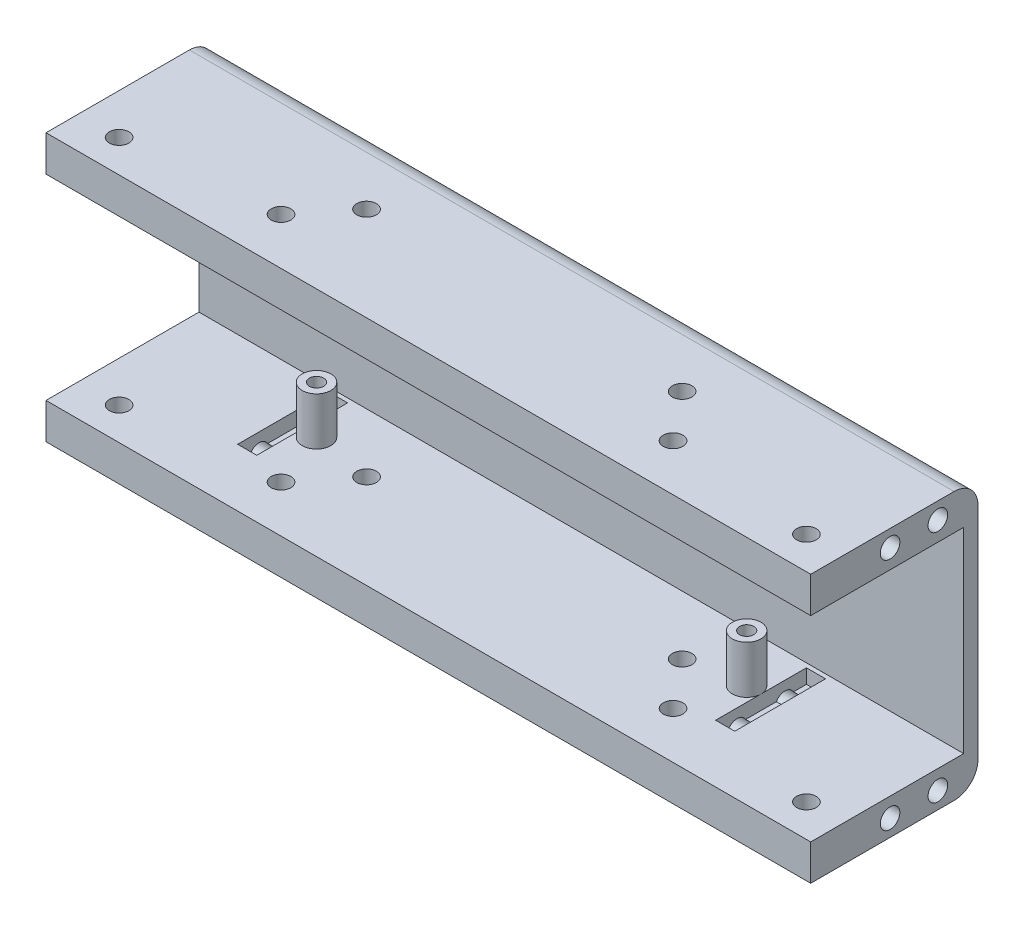
from build123d import *

# Parameters (mm, degrees)
SKETCH1_W               = 160
SKETCH1_H               = 56
BOSS_EXTRUDE1_DEPTH     = 35
SKETCH2_W               = 32
SKETCH2_H               = 41
CUT_EXTRUDE1_DEPTH      = 167.159561868
FILLET1_R               = 5
SKETCH6_W               = 4
SKETCH6_H               = 19
CUT_EXTRUDE4_DEPTH      = 3
MIRROR4_COPY_1_SKETCH_W = 4
MIRROR4_COPY_1_SKETCH_H = 19
MIRROR4_COPY_1_DEPTH    = 3
SKETCH8_R               = 2.05
CUT_EXTRUDE6_DEPTH      = 167.159561868
SKETCH9_R               = 2.05
CUT_EXTRUDE7_DEPTH      = 104.735239914
SKETCH10_R              = 3
SKETCH10_R_2            = 1.5
BOSS_EXTRUDE3_DEPTH     = 10
SKETCH13_R              = 1.5
CUT_EXTRUDE9_DEPTH      = 96.431913025


with BuildPart() as part:
    # Sketch1 → Boss-Extrude1 (new body)
    with BuildSketch(Plane.XY):
        Rectangle(SKETCH1_W, SKETCH1_H)
    extrude(amount=BOSS_EXTRUDE1_DEPTH)

    # Sketch2 → Cut-Extrude1 (cut, through all)
    with BuildSketch(Plane.ZY.offset(80)):
        with Locations((19, 0)):
            Rectangle(SKETCH2_W, SKETCH2_H)
    extrude(amount=-CUT_EXTRUDE1_DEPTH, mode=Mode.SUBTRACT)

    # Fillet1
    fillet1_edges = [part.edges().sort_by_distance(p)[0] for p in [
        (0, -28, 0),
        (0, 28, 0),
    ]]
    fillet(fillet1_edges, radius=FILLET1_R)

    # Sketch6 → Cut-Extrude4 (cut)
    with BuildSketch(Plane.XZ.offset(-20.5)):
        with Locations((-50, 13.4)):
            Rectangle(SKETCH6_W, SKETCH6_H)
    cut_extrude4 = extrude(amount=-CUT_EXTRUDE4_DEPTH, mode=Mode.SUBTRACT)

    # Mirror3: Cut-Extrude4 across plane
    add(cut_extrude4.mirror(Plane.ZY), mode=Mode.SUBTRACT)

    # Mirror4: Cut-Extrude4 across plane
    add(cut_extrude4.mirror(Plane.ZX), mode=Mode.SUBTRACT)

    # Mirror4 copy 1 sketch → Mirror4 copy 1 (cut)
    with BuildSketch(Plane(origin=(0, -20.5, 0), x_dir=(-1, 0, 0), z_dir=(0, 1, 0))):
        with Locations((-50, 13.4)):
            Rectangle(MIRROR4_COPY_1_SKETCH_W, MIRROR4_COPY_1_SKETCH_H)
    extrude(amount=-MIRROR4_COPY_1_DEPTH, mode=Mode.SUBTRACT)

    # Sketch8 → Cut-Extrude6 (cut, through all)
    with BuildSketch(Plane.ZY.offset(80)):
        with Locations((18.4, -24.5)):
            Circle(SKETCH8_R)
        with Locations((8.4, -24.5)):
            Circle(SKETCH8_R)
    cut_extrude6 = extrude(amount=-CUT_EXTRUDE6_DEPTH, mode=Mode.SUBTRACT)

    # Mirror5: Cut-Extrude6 across plane
    add(cut_extrude6.mirror(Plane.ZX), mode=Mode.SUBTRACT)

    # Sketch9 → Cut-Extrude7 (cut, through all)
    with BuildSketch(Plane(origin=(0, 28, 0), x_dir=(1, 0, 0), z_dir=(0, 1, 0))):
        with Locations(Location((41.410879364, -25.216075278, 0), (0, 0, 270))):
            Circle(SKETCH9_R)
        with Locations(Location((33.410879423, -15.320010713, 0), (0, 0, 270))):
            Circle(SKETCH9_R)
        with Locations(Location((72.304393308, -28.203284125, 0), (0, 0, 270))):
            Circle(SKETCH9_R)
        with Locations(Location((-32.610879423, -15.320010713, 0), (0, 0, 270))):
            Circle(SKETCH9_R)
        with Locations(Location((-40.610879364, -25.216075278, 0), (0, 0, 270))):
            Circle(SKETCH9_R)
        with Locations(Location((-71.504393308, -28.203284125, 0), (0, 0, 270))):
            Circle(SKETCH9_R)
    extrude(amount=-CUT_EXTRUDE7_DEPTH, mode=Mode.SUBTRACT)

    # Sketch10 → Boss-Extrude3 (add)
    with BuildSketch(Plane(origin=(0, -20.5, 0), x_dir=(1, 0, 0), z_dir=(0, 1, 0))):
        with Locations(Location((-45, -13.4, 0), (0, 0, 180))):
            Circle(SKETCH10_R)
        with Locations(Location((-45, -13.4, 0), (0, 0, 270))):
            Circle(SKETCH10_R_2, mode=Mode.SUBTRACT)
    boss_extrude3 = extrude(amount=BOSS_EXTRUDE3_DEPTH)

    # Sketch13 → Cut-Extrude9 (cut, through all)
    with BuildSketch(Plane(origin=(0, -10.5, 0), x_dir=(1, 0, 0), z_dir=(0, 1, 0))):
        with Locations(Location((-45, -13.4, 0), (0, 0, 270))):
            Circle(SKETCH13_R)
    cut_extrude9 = extrude(amount=-CUT_EXTRUDE9_DEPTH, mode=Mode.SUBTRACT)

    # Mirror6: Boss-Extrude3, Cut-Extrude9 across plane
    add(boss_extrude3.mirror(Plane.ZY))
    add(cut_extrude9.mirror(Plane.ZY), mode=Mode.SUBTRACT)


solid = part.part
